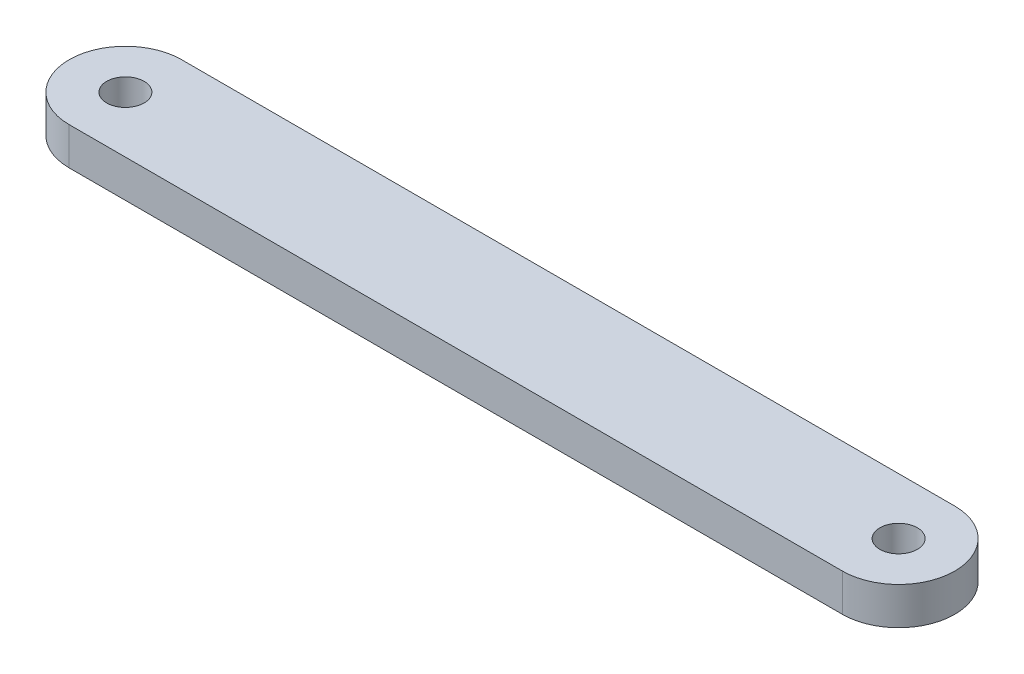
from build123d import *

# Parameters (mm, degrees)
SKETCH1_R           = 2.4
BOSS_EXTRUDE1_DEPTH = 5
SCALE1_SCALE        = 0.8
SKETCH2_R           = 2
CUT_EXTRUDE1_DEPTH  = 48.792424581


with BuildPart() as part:
    # Sketch1 → Boss-Extrude1 (new body)
    with BuildSketch(Plane(origin=(0, 0, 0), x_dir=(1, 0, 0), z_dir=(0, 1, 0))):
        with BuildLine():
            Line((-51.5565916, 7.5), (51.5565916, 7.5))
            ThreePointArc((51.5565916, 7.5), (59.0565916, 0), (51.5565916, -7.5))
            Line((51.5565916, -7.5), (-51.5565916, -7.5))
            ThreePointArc((-51.5565916, -7.5), (-59.0565916, 0), (-51.5565916, 7.5))
        make_face()
        with Locations(Location((-51.5565916, 0, 0), (0, 0, 270))):
            Circle(SKETCH1_R, mode=Mode.SUBTRACT)
        with Locations(Location((51.5565916, 0, 0), (0, 0, 270))):
            Circle(SKETCH1_R, mode=Mode.SUBTRACT)
    extrude(amount=BOSS_EXTRUDE1_DEPTH)


with BuildPart() as part_1:
    # Scale1: scaled about (0, 2.5, 0)
    add(part.part.scale(SCALE1_SCALE).moved(Location((0, 0.5, 0))))

    # Sketch2 → Cut-Extrude1 (cut, through all)
    with BuildSketch(Plane(origin=(0, 4.5, 0), x_dir=(1, 0, 0), z_dir=(0, 1, 0))):
        with Locations(Location((-41.24527328, 0, 0), (0, 0, 270))):
            Circle(SKETCH2_R)
        with Locations(Location((41.24527328, 0, 0), (0, 0, 270))):
            Circle(SKETCH2_R)
    extrude(amount=-CUT_EXTRUDE1_DEPTH, mode=Mode.SUBTRACT)


solid = part_1.part
